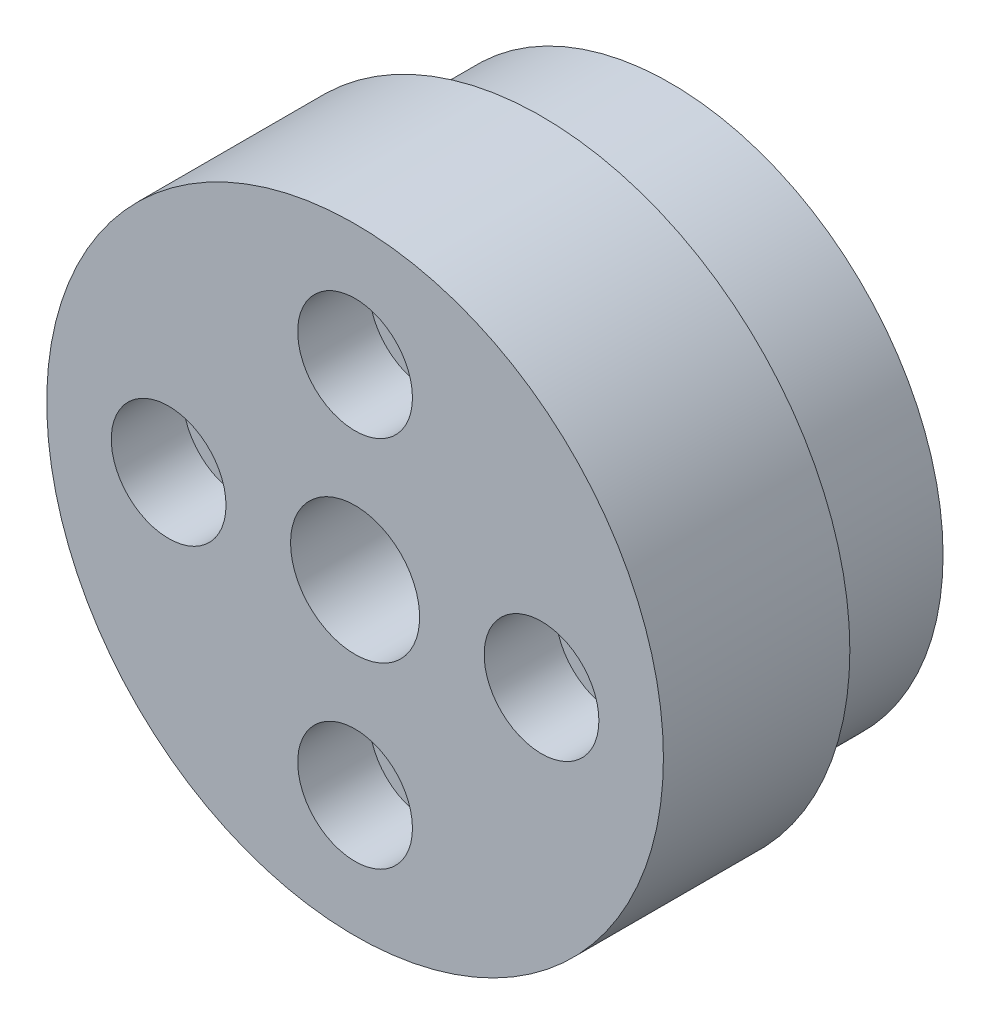
from build123d import *

# Parameters (mm, degrees)
SKETCH1_R           = 9.5
BOSS_EXTRUDE1_DEPTH = 11
SKETCH1_3_R         = 10.75
SKETCH1_3_R_2       = 9.5
BOSS_EXTRUDE2_DEPTH = 6.5
SKETCH3_R           = 1.35
CUT_EXTRUDE2_DEPTH  = 19.764994005
SKETCH4_R           = 2.25
CUT_EXTRUDE4_DEPTH  = 19.764994005
CUT_EXTRUDE5_START  = -8.5
SKETCH3_4_R         = 2
SKETCH3_4_R_2       = 1.35
CUT_EXTRUDE5_DEPTH  = 2.5


with BuildPart() as part:
    # Sketch1 → Boss-Extrude1 (new body)
    with BuildSketch(Plane.XY):
        Circle(SKETCH1_R)
    extrude(amount=-BOSS_EXTRUDE1_DEPTH)

    # Sketch1<3> → Boss-Extrude2 (add)
    with BuildSketch(Plane.XY):
        Circle(SKETCH1_3_R)
        Circle(SKETCH1_3_R_2, mode=Mode.SUBTRACT)
    extrude(amount=-BOSS_EXTRUDE2_DEPTH)

    # Sketch3 → Cut-Extrude2 (cut, through all)
    with BuildSketch(Plane(origin=(0, 0, -11), x_dir=(-1, 0, 0), z_dir=(0, 0, -1))):
        with Locations((0, 6.5)):
            Circle(SKETCH3_R)
        with Locations((-6.5, 0)):
            Circle(SKETCH3_R)
        with Locations((6.5, 0)):
            Circle(SKETCH3_R)
        with Locations((0, -6.5)):
            Circle(SKETCH3_R)
    extrude(amount=-CUT_EXTRUDE2_DEPTH, mode=Mode.SUBTRACT)

    # Sketch4 → Cut-Extrude4 (cut, through all)
    with BuildSketch(Plane(origin=(0, 0, -11), x_dir=(-1, 0, 0), z_dir=(0, 0, -1))):
        Circle(SKETCH4_R)
    extrude(amount=-CUT_EXTRUDE4_DEPTH, mode=Mode.SUBTRACT)

    # Sketch3<4> → Cut-Extrude5 (cut)
    # profile 1 of 4: a face of its own
    with BuildSketch(Plane(origin=(0, 0, -11), x_dir=(-1, 0, 0), z_dir=(0, 0, -1)).offset(CUT_EXTRUDE5_START)):
        with Locations(Location((-6.5, 0, 0), (0, 0, 180))):
            Circle(SKETCH3_4_R)
        with Locations((-6.5, 0)):
            Circle(SKETCH3_4_R_2, mode=Mode.SUBTRACT)
    # profile 2 of 4: a face of its own
    with BuildSketch(Plane(origin=(0, 0, -11), x_dir=(-1, 0, 0), z_dir=(0, 0, -1)).offset(CUT_EXTRUDE5_START)):
        with Locations(Location((0, 6.5, 0), (0, 0, 180))):
            Circle(SKETCH3_4_R)
        with Locations((0, 6.5)):
            Circle(SKETCH3_4_R_2, mode=Mode.SUBTRACT)
    # profile 3 of 4: a face of its own
    with BuildSketch(Plane(origin=(0, 0, -11), x_dir=(-1, 0, 0), z_dir=(0, 0, -1)).offset(CUT_EXTRUDE5_START)):
        with Locations(Location((6.5, 0, 0), (0, 0, 180))):
            Circle(SKETCH3_4_R)
        with Locations((6.5, 0)):
            Circle(SKETCH3_4_R_2, mode=Mode.SUBTRACT)
    # profile 4 of 4: a face of its own
    with BuildSketch(Plane(origin=(0, 0, -11), x_dir=(-1, 0, 0), z_dir=(0, 0, -1)).offset(CUT_EXTRUDE5_START)):
        with Locations(Location((0, -6.5, 0), (0, 0, 180))):
            Circle(SKETCH3_4_R)
        with Locations((0, -6.5)):
            Circle(SKETCH3_4_R_2, mode=Mode.SUBTRACT)
    extrude(amount=-CUT_EXTRUDE5_DEPTH, mode=Mode.SUBTRACT)


solid = part.part
